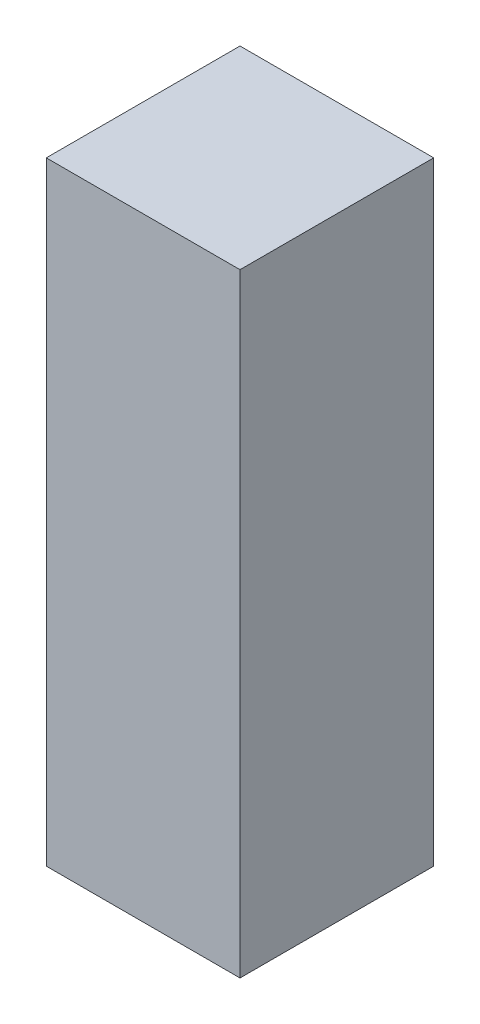
from build123d import *

# Parameters (mm, degrees)
CROQUIS1_W              = 48
CROQUIS1_H              = 152
SALIENTE_EXTRUIR1_DEPTH = 48


with BuildPart() as part:
    # Croquis1 → Saliente-Extruir1 (new body)
    with BuildSketch(Plane.XY):
        with Locations((24, 76)):
            Rectangle(CROQUIS1_W, CROQUIS1_H)
    extrude(amount=SALIENTE_EXTRUIR1_DEPTH)


solid = part.part
